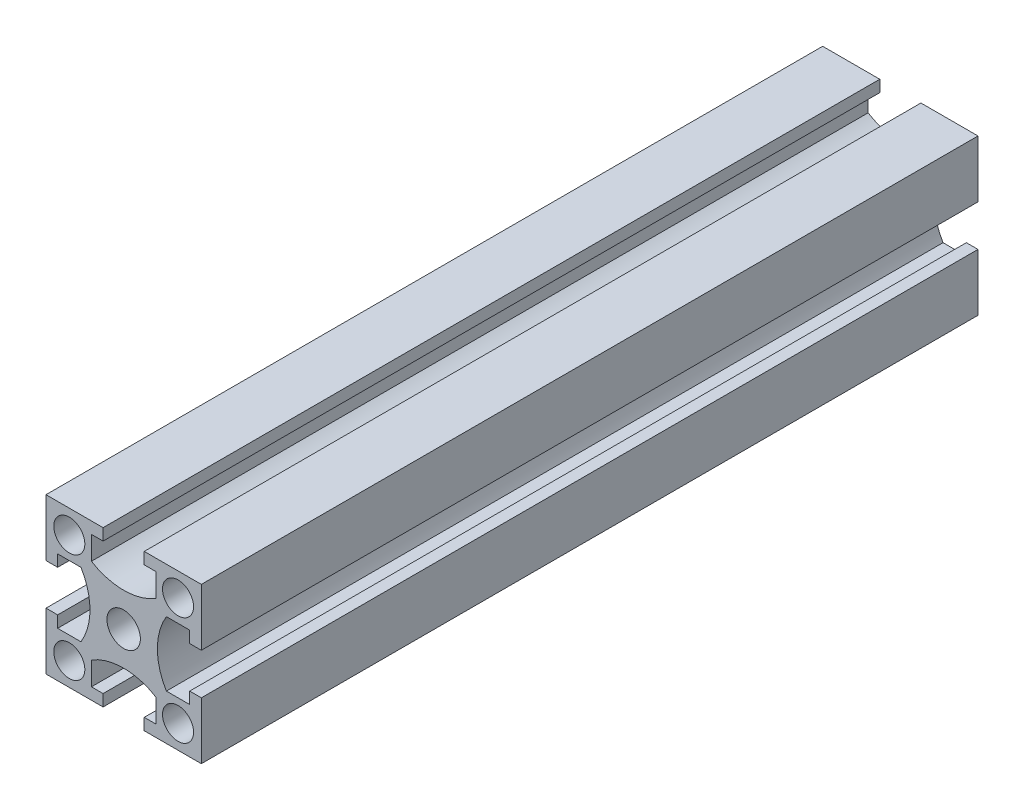
from build123d import *

# Parameters (mm, degrees)
SKETCH_1_W          = 20
SKETCH_1_H          = 20
EXTRUDE_1_DEPTH     = 100
SKETCH_2_R          = 2.15
SKETCH_2_R_2        = 2
CUT_EXTRUDE_1_DEPTH = 300


with BuildPart() as part:
    # 스케치1 → 보스-돌출1 (new body)
    with BuildSketch(Plane.XY):
        Rectangle(SKETCH_1_W, SKETCH_1_H)
    extrude(amount=EXTRUDE_1_DEPTH)

    # 스케치2 → 컷-돌출1 (cut)
    with BuildSketch(Plane.XY.offset(100)):
        Circle(SKETCH_2_R)
        with Locations((-7, 7)):
            Circle(SKETCH_2_R_2)
        with Locations((7, 7)):
            Circle(SKETCH_2_R_2)
        with Locations((7, -7)):
            Circle(SKETCH_2_R_2)
        with Locations((-7, -7)):
            Circle(SKETCH_2_R_2)
        with BuildLine():
            Line((-2.65, 10), (-2.65, 8.5))
            Line((-2.65, 8.5), (-4.15, 8.5))
            Line((-4.15, 8.5), (-4.15, 5.5))
            ThreePointArc((-4.15, 5.5), (0, 4.339407869), (4.15, 5.5))
            Line((4.15, 5.5), (4.15, 8.5))
            Line((4.15, 8.5), (2.65, 8.5))
            Line((2.65, 8.5), (2.65, 10))
            Line((2.65, 10), (-2.65, 10))
        make_face()
        with BuildLine():
            Line((10, 2.65), (8.5, 2.65))
            Line((8.5, 2.65), (8.5, 4.15))
            Line((8.5, 4.15), (5.5, 4.15))
            ThreePointArc((5.5, 4.15), (4.339407869, 0), (5.5, -4.15))
            Line((5.5, -4.15), (8.5, -4.15))
            Line((8.5, -4.15), (8.5, -2.65))
            Line((8.5, -2.65), (10, -2.65))
            Line((10, -2.65), (10, 2.65))
        make_face()
        with BuildLine():
            Line((2.65, -10), (2.65, -8.5))
            Line((2.65, -8.5), (4.15, -8.5))
            Line((4.15, -8.5), (4.15, -5.5))
            ThreePointArc((4.15, -5.5), (0, -4.339407869), (-4.15, -5.5))
            Line((-4.15, -5.5), (-4.15, -8.5))
            Line((-4.15, -8.5), (-2.65, -8.5))
            Line((-2.65, -8.5), (-2.65, -10))
            Line((-2.65, -10), (2.65, -10))
        make_face()
        with BuildLine():
            Line((-10, -2.65), (-8.5, -2.65))
            Line((-8.5, -2.65), (-8.5, -4.15))
            Line((-8.5, -4.15), (-5.5, -4.15))
            ThreePointArc((-5.5, -4.15), (-4.339407869, 0), (-5.5, 4.15))
            Line((-5.5, 4.15), (-8.5, 4.15))
            Line((-8.5, 4.15), (-8.5, 2.65))
            Line((-8.5, 2.65), (-10, 2.65))
            Line((-10, 2.65), (-10, -2.65))
        make_face()
    extrude(amount=-CUT_EXTRUDE_1_DEPTH, mode=Mode.SUBTRACT)


solid = part.part
